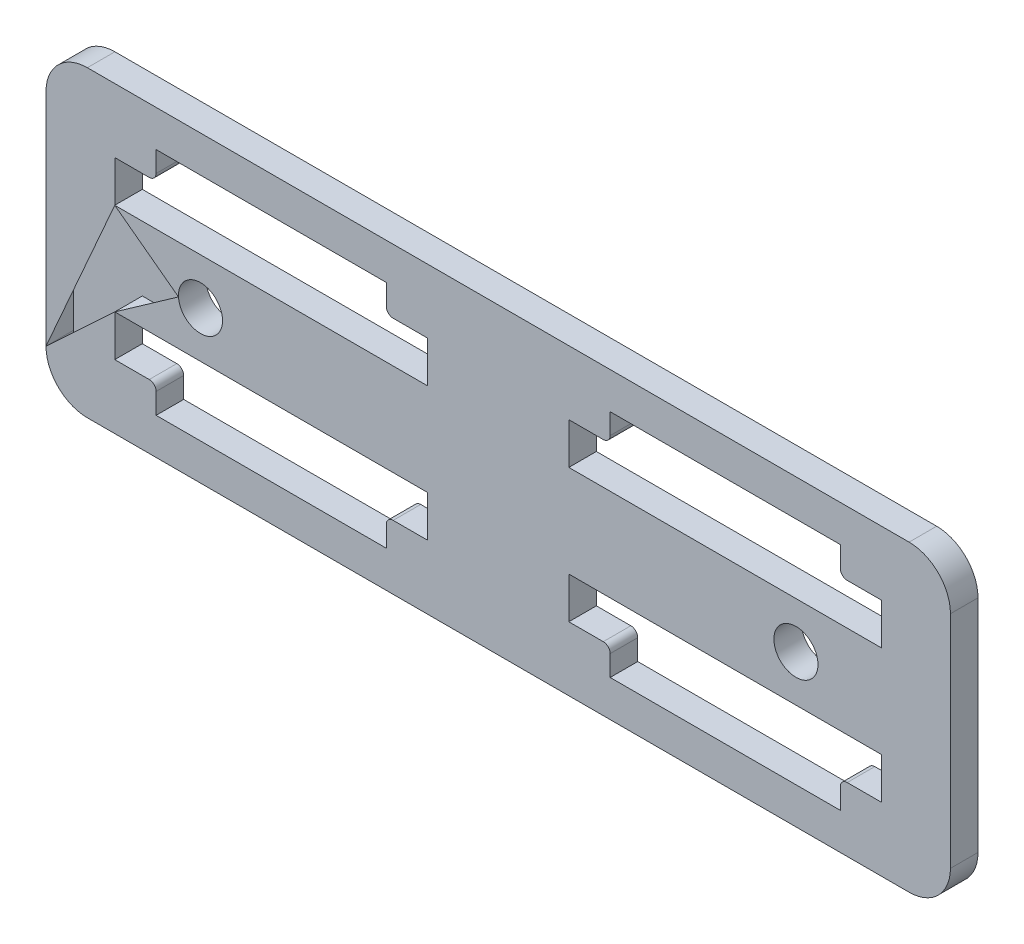
from build123d import *

# Parameters (mm, degrees)
SKETCH_1_R      = 1.6
EXTRUDE_1_DEPTH = 2


with BuildPart() as part:
    # 草图1 → 凸台-拉伸1 (new body)
    with BuildSketch(Plane.XY):
        with BuildLine():
            Line((-29.812520549, 11), (29.812520549, 11))
            ThreePointArc((29.812520549, 11), (31.933840892, 10.121320344), (32.812520549, 8))
            Line((32.812520549, 8), (32.812520549, -8))
            ThreePointArc((32.812520549, -8), (31.933840892, -10.121320344), (29.812520549, -11))
            Line((29.812520549, -11), (-29.812520549, -11))
            ThreePointArc((-29.812520549, -11), (-31.933840892, -10.121320344), (-32.812520549, -8))
            Line((-32.812520549, -8), (-32.812520549, 8))
            ThreePointArc((-32.812520549, 8), (-31.933840892, 10.121320344), (-29.812520549, 11))
        make_face()
        with Locations((-21.602967139, 3e-09)):
            Circle(SKETCH_1_R, mode=Mode.SUBTRACT)
        with Locations(Location((21.602967139, 3e-09, 0), (0, 0, 180))):
            Circle(SKETCH_1_R, mode=Mode.SUBTRACT)
        with BuildLine():
            Line((-27.82296712, -6.350000006), (-25.322967139, -6.350000006))
            ThreePointArc((-25.322967139, -6.350000006), (-24.969413752, -6.496446613), (-24.822967144, -6.850000001))
            Line((-24.822967144, -6.850000001), (-24.822967144, -8.350000009))
            Line((-24.822967144, -8.350000009), (-8.122967147, -8.350000009))
            Line((-8.122967147, -8.350000009), (-8.122967147, -6.850000006))
            ThreePointArc((-8.122967147, -6.850000006), (-7.976520539, -6.496446619), (-7.622967152, -6.350000011))
            Line((-7.622967152, -6.350000011), (-5.122967162, -6.350000011))
            Line((-5.122967162, -6.350000011), (-5.122967162, -3.349999976))
            Line((-5.122967162, -3.349999976), (-27.82296712, -3.349999976))
            Line((-27.82296712, -3.349999976), (-27.82296712, -6.350000006))
        make_face(mode=Mode.SUBTRACT)
        with BuildLine():
            Line((-8.12296715, 8.350000017), (-24.822967148, 8.350000017))
            Line((-24.822967148, 8.350000017), (-24.822967148, 6.850000008))
            ThreePointArc((-24.822967148, 6.850000008), (-24.969413756, 6.496446621), (-25.322967143, 6.350000013))
            Line((-25.322967143, 6.350000013), (-27.822967124, 6.350000013))
            Line((-27.822967124, 6.350000013), (-27.822967124, 3.349999975))
            Line((-27.822967124, 3.349999975), (-5.122967149, 3.349999975))
            Line((-5.122967149, 3.349999975), (-5.122967149, 6.350000013))
            Line((-5.122967149, 6.350000013), (-7.622967155, 6.350000013))
            ThreePointArc((-7.622967155, 6.350000013), (-7.976520542, 6.496446621), (-8.12296715, 6.850000008))
            Line((-8.12296715, 6.850000008), (-8.12296715, 8.350000017))
        make_face(mode=Mode.SUBTRACT)
        with BuildLine():
            Line((24.822967148, 8.350000017), (24.822967148, 6.850000008))
            ThreePointArc((24.822967148, 6.850000008), (24.969413756, 6.496446621), (25.322967143, 6.350000013))
            Line((25.322967143, 6.350000013), (27.822967124, 6.350000013))
            Line((27.822967124, 6.350000013), (27.822967124, 3.349999975))
            Line((27.822967124, 3.349999975), (5.122967149, 3.349999975))
            Line((5.122967149, 3.349999975), (5.122967149, 6.350000013))
            Line((5.122967149, 6.350000013), (7.622967155, 6.350000013))
            ThreePointArc((7.622967155, 6.350000013), (7.976520542, 6.496446621), (8.12296715, 6.850000008))
            Line((8.12296715, 6.850000008), (8.12296715, 8.350000017))
            Line((8.12296715, 8.350000017), (24.822967148, 8.350000017))
        make_face(mode=Mode.SUBTRACT)
        with BuildLine():
            Line((24.822967144, -6.850000001), (24.822967144, -8.350000009))
            Line((24.822967144, -8.350000009), (8.122967147, -8.350000009))
            Line((8.122967147, -8.350000009), (8.122967147, -6.850000006))
            ThreePointArc((8.122967147, -6.850000006), (7.976520539, -6.496446619), (7.622967152, -6.350000011))
            Line((7.622967152, -6.350000011), (5.122967162, -6.350000011))
            Line((5.122967162, -6.350000011), (5.122967162, -3.349999976))
            Line((5.122967162, -3.349999976), (27.82296712, -3.349999976))
            Line((27.82296712, -3.349999976), (27.82296712, -6.350000006))
            Line((27.82296712, -6.350000006), (25.322967139, -6.350000006))
            ThreePointArc((25.322967139, -6.350000006), (24.969413752, -6.496446613), (24.822967144, -6.850000001))
        make_face(mode=Mode.SUBTRACT)
    extrude(amount=EXTRUDE_1_DEPTH)


solid = part.part
